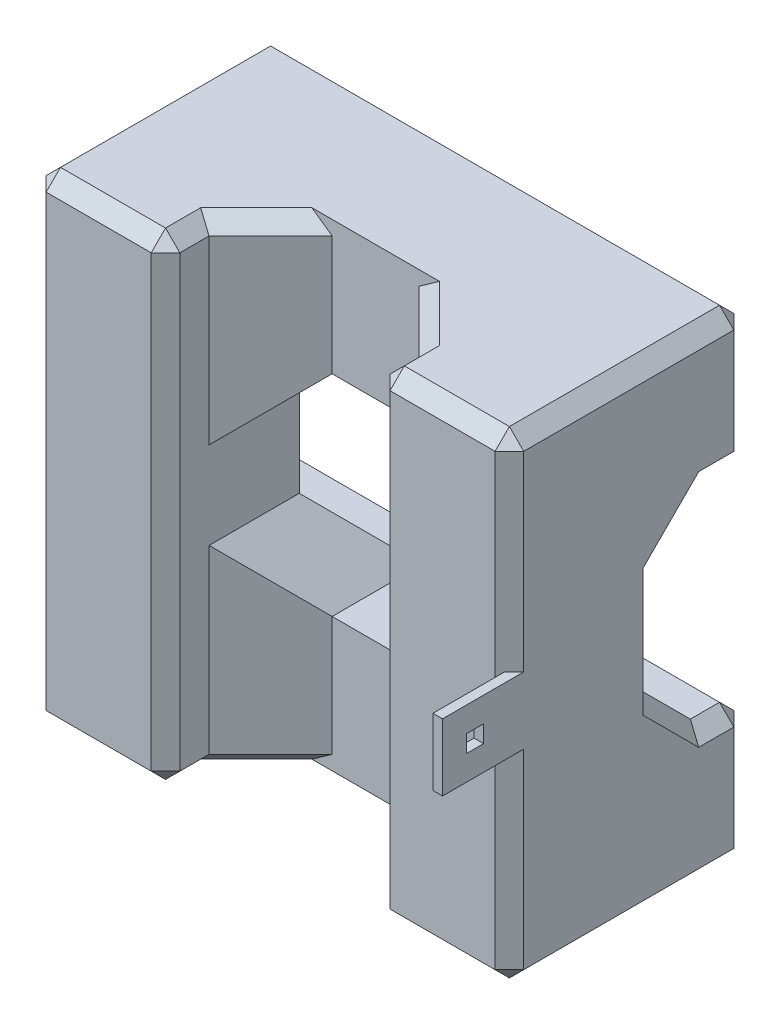
from build123d import *

# Parameters (mm, degrees)
SKETCH1_W                = 50
SKETCH1_H                = 50
BOSS_EXTRUDE1_DEPTH      = 25
CUT_EXTRUDE1_DEPTH       = 76
CUT_EXTRUDE2_DEPTH       = 76
CUT_EXTRUDE3_DEPTH       = 76
CHAMFER1_SIZE            = 1.5
BOSS_EXTRUDE2_DEPTH      = 7
BOSS_EXTRUDE2_DEPTH_BACK = 10
SKETCH5_W                = 1
SKETCH5_H                = 7
SKETCH6_W                = 1.8
SKETCH6_H                = 1.8
CUT_EXTRUDE5_DEPTH       = 78.614431648


with BuildPart() as part:
    # Sketch1 → Boss-Extrude1 (new body)
    with BuildSketch(Plane.XY):
        with Locations((25, 25)):
            Rectangle(SKETCH1_W, SKETCH1_H)
    extrude(amount=BOSS_EXTRUDE1_DEPTH)

    # Sketch2 → Cut-Extrude1 (cut, through all)
    with BuildSketch(Plane.XZ):
        Polygon((29.556349186, 36), (20.443650814, 36), (14, 29.556349186), (14, 20.443650814), (20.443650814, 14), (29.556349186, 14), (36, 20.443650814), (36, 29.556349186), align=None)
    extrude(amount=-CUT_EXTRUDE1_DEPTH, mode=Mode.SUBTRACT)

    # Sketch3 → Cut-Extrude2 (cut, through all)
    with BuildSketch(Plane.ZY):
        Polygon((4.556349186, 14), (11, 20.443650814), (11, 29.556349186), (4.556349186, 36), (-4.556349186, 36), (-11, 29.556349186), (-11, 20.443650814), (-4.556349186, 14), align=None)
    extrude(amount=-CUT_EXTRUDE2_DEPTH, mode=Mode.SUBTRACT)

    # Sketch4 → Cut-Extrude3 (cut, through all)
    with BuildSketch(Plane.XY.offset(25)):
        Polygon((29.556349186, 36), (20.443650814, 36), (14, 29.556349186), (14, 20.443650814), (20.443650814, 14), (29.556349186, 14), (36, 20.443650814), (36, 29.556349186), align=None)
    extrude(amount=-CUT_EXTRUDE3_DEPTH, mode=Mode.SUBTRACT)

    # Chamfer1
    chamfer1_edges = [part.edges().sort_by_distance(p)[0] for p in [
        (50, 25, 25),
        (43, 50, 25),
        (43, 0, 25),
        (7, 50, 25),
        (14, 25, 25),
        (36, 25, 25),
        (36, 50, 22.721825407),
        (14, 50, 22.721825407),
        (36, 0, 22.721825407),
        (14, 0, 22.721825407),
        (17.221825407, 0, 17.221825407),
        (32.778174593, 0, 17.221825407),
        (32.778174593, 50, 17.221825407),
        (17.221825407, 50, 17.221825407),
        (0, 25, 25),
        (25, 50, 0),
        (50, 7, 0),
        (0, 7, 0),
        (50, 43, 0),
        (25, 36, 0),
        (25, 14, 0),
        (25, 0, 0),
        (0, 43, 0),
        (50, 14, 2.278174593),
        (50, 36, 2.278174593),
        (50, 32.778174593, 7.778174593),
        (50, 17.221825407, 7.778174593),
        (0, 14, 2.278174593),
        (0, 17.221825407, 7.778174593),
        (0, 32.778174593, 7.778174593),
        (0, 36, 2.278174593),
        (7, 0, 25),
        (0, 50, 12.5),
        (50, 50, 12.5),
        (50, 0, 12.5),
        (0, 0, 12.5),
    ]]
    chamfer(chamfer1_edges, length=CHAMFER1_SIZE)

    # Sketch5 → Boss-Extrude2 (add, two sides: drawn at the far end of the back side and taken through both)
    with BuildSketch(Plane.XY.offset(25).offset(-BOSS_EXTRUDE2_DEPTH_BACK)):
        with Locations((49.5, 25)):
            Rectangle(SKETCH5_W, SKETCH5_H)
    extrude(amount=BOSS_EXTRUDE2_DEPTH + BOSS_EXTRUDE2_DEPTH_BACK)

    # Sketch6 → Cut-Extrude5 (cut, through all)
    with BuildSketch(Plane(origin=(50, 0, 0), x_dir=(0, 0, -1), z_dir=(1, 0, 0))):
        with Locations((-28.6, 25)):
            Rectangle(SKETCH6_W, SKETCH6_H)
    extrude(amount=-CUT_EXTRUDE5_DEPTH, mode=Mode.SUBTRACT)


solid = part.part
